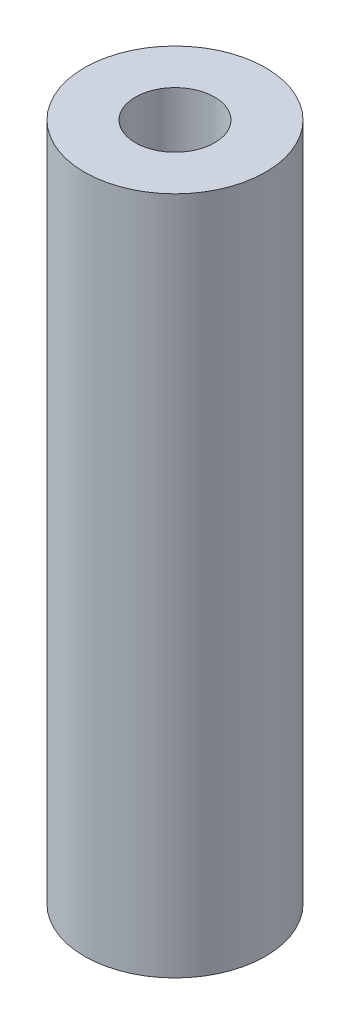
from build123d import *

# Parameters (mm, degrees)
SKETCH_1_R      = 4
SKETCH_1_R_2    = 1.75
EXTRUDE_1_DEPTH = 30


with BuildPart() as part:
    # 草图1 → 凸台-拉伸1 (new body)
    with BuildSketch(Plane(origin=(0, 0, 0), x_dir=(1, 0, 0), z_dir=(0, 1, 0))):
        with Locations(Location((-0.795143337, 0.384950346, 0), (0, 0, 270))):
            Circle(SKETCH_1_R)
        with Locations(Location((-0.795143337, 0.384950346, 0), (0, 0, 270))):
            Circle(SKETCH_1_R_2, mode=Mode.SUBTRACT)
    extrude(amount=EXTRUDE_1_DEPTH)


solid = part.part
